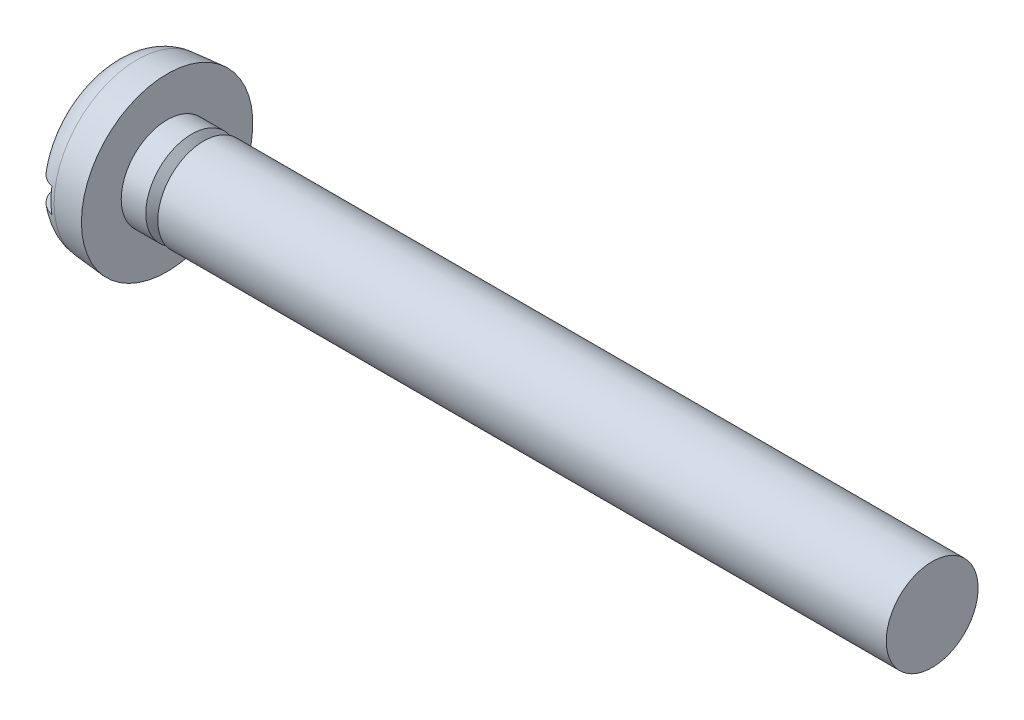
from build123d import *

# Parameters (mm, degrees)
FILLET2_R  = 0.9
SKETCH2_W  = 5.6
SKETCH2_H  = 0.8
SLOT_DEPTH = 0.7


with BuildPart() as part:
    # BodySke → Base-Revolve (revolve)
    with BuildSketch(Plane.XY):
        Polygon((1.8, 1.5), (1.8, 2.8), (0, 2.642520406), (0, 0), (26.8, 0), (26.8, 1.5), align=None)
    revolve(axis=Axis((-25.4, 0, 0), (1, 0, 0)))

    # Fillet2
    fillet2_edges = [part.edges().sort_by_distance(p)[0] for p in [
        (0, -2.642520406, 0),
    ]]
    fillet(fillet2_edges, radius=FILLET2_R)

    # Sketch2 → Slot (cut)
    with BuildSketch(Plane(origin=(0, 0, 0), x_dir=(0, 0, -1), z_dir=(1, 0, 0))):
        Rectangle(SKETCH2_W, SKETCH2_H)
    extrude(amount=SLOT_DEPTH, mode=Mode.SUBTRACT)

    # ThdSchSke → ThreadSchematic (revolve, cut)
    with BuildSketch(Plane.XY):
        Polygon((2.8, -1.2195), (2.603591786, -1.5), (2.603591786, -1.875), (2.996408214, -1.875), (2.996408214, -1.5), align=None)
    revolve(axis=Axis((-3.175, 0, 0), (1, 0, 0)), mode=Mode.SUBTRACT)


solid = part.part
